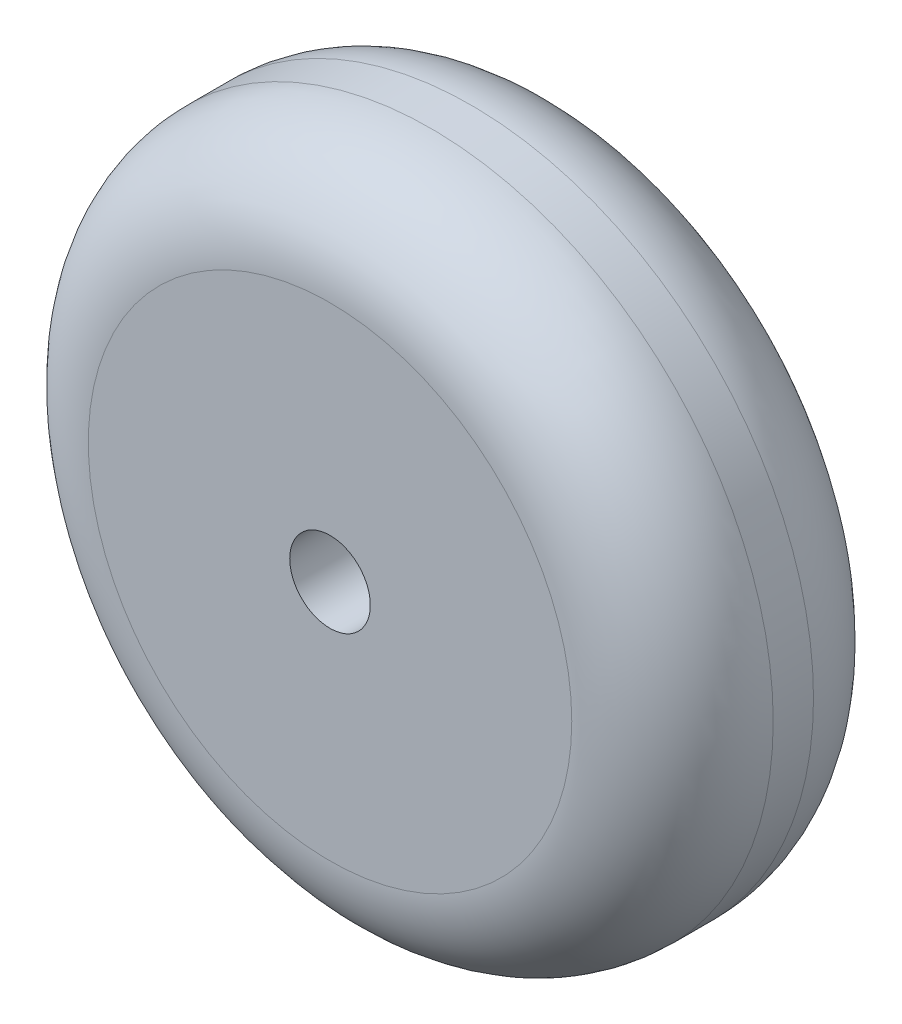
from build123d import *

# Parameters (mm, degrees)
SKETCH1_R          = 85
WHEEL_DEPTH        = 60
FILLET1_R          = 25
SKETCH4_R          = 10
CUT_EXTRUDE1_DEPTH = 135.350288489


with BuildPart() as part:
    # Sketch1 → WHEEL (new body)
    with BuildSketch(Plane.XY):
        Circle(SKETCH1_R)
    extrude(amount=WHEEL_DEPTH)

    # Fillet1
    fillet1_edges = [part.edges().sort_by_distance(p)[0] for p in [
        (-85, 0, 0),
        (-85, 0, 60),
    ]]
    fillet(fillet1_edges, radius=FILLET1_R)

    # Sketch4 → Cut-Extrude1 (cut, through all)
    with BuildSketch(Plane(origin=(0, 0, 0), x_dir=(-1, 0, 0), z_dir=(0, 0, -1))):
        Circle(SKETCH4_R)
    extrude(amount=-CUT_EXTRUDE1_DEPTH, mode=Mode.SUBTRACT)


solid = part.part
